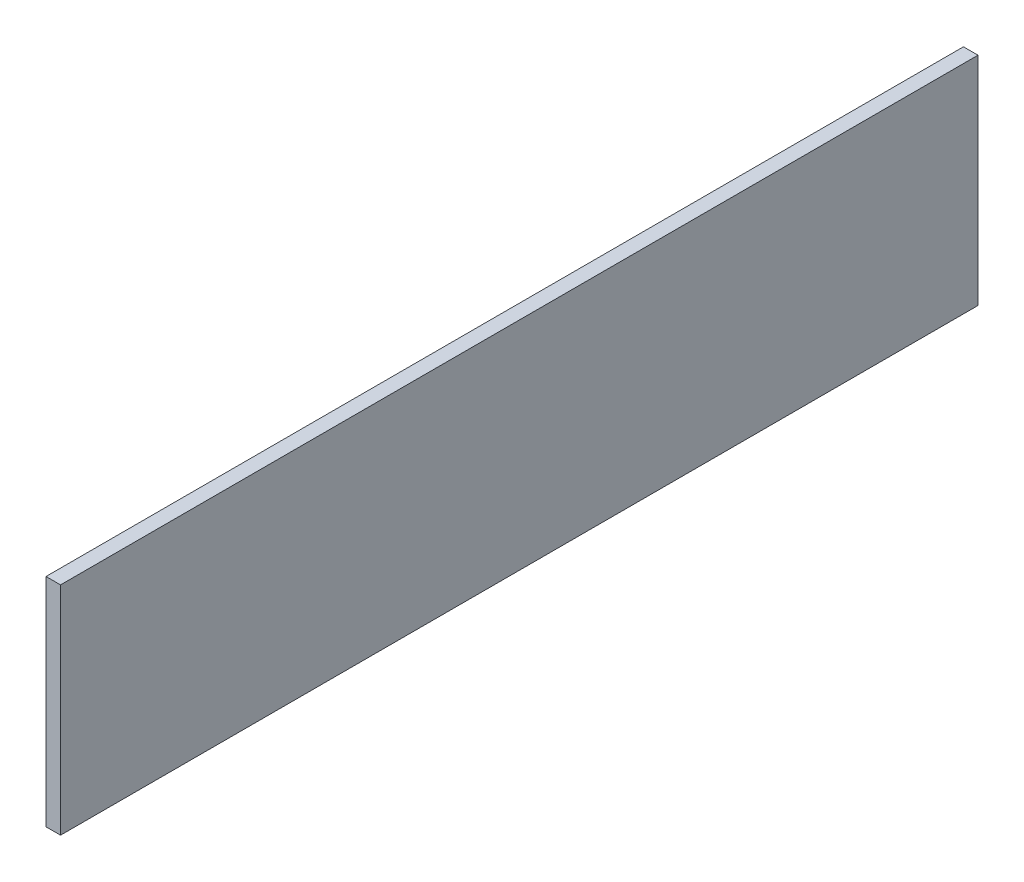
from build123d import *

# Parameters (mm, degrees)
SKETCH1_W                  = 12
SKETCH1_H                  = 179
DET_BOLME_SACI_SOL_1_DEPTH = 757.5


with BuildPart() as part:
    # Sketch1 → DET_bolme_saci_sol_1 (new body)
    with BuildSketch(Plane.XY):
        with Locations((708, 1558.5)):
            Rectangle(SKETCH1_W, SKETCH1_H)
    extrude(amount=-DET_BOLME_SACI_SOL_1_DEPTH)


solid = part.part
